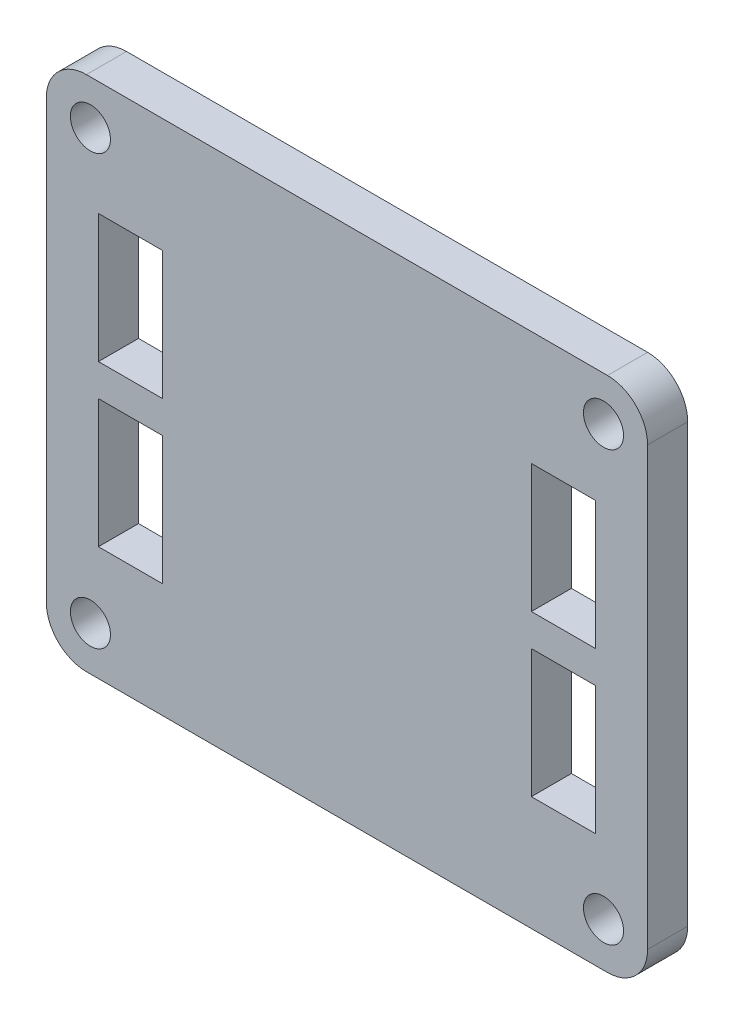
from build123d import *

# Parameters (mm, degrees)
SKETCH_1_W           = 75
SKETCH_1_H           = 64.5
EXTRUDE_1_DEPTH      = 5
EXTRUDE_2_DEPTH      = 2
EXTRUDE_2_DEPTH_BACK = 2
SKETCH_4_R           = 2.5
CUT_EXTRUDE_2_DEPTH  = 60.516345229
SKETCH_5_W           = 8
SKETCH_5_H           = 16
CUT_EXTRUDE_3_DEPTH  = 60.516345229
FILLET_1_R           = 5
SKETCH_6_W           = 33.787770844
SKETCH_6_H           = 60.601542709
CUT_EXTRUDE_4_DEPTH  = 10


with BuildPart() as part:
    # 草圖1 → 填料-伸長1 (new body)
    with BuildSketch(Plane.XY):
        Rectangle(SKETCH_1_W, SKETCH_1_H)
    extrude(amount=EXTRUDE_1_DEPTH)

    # 草圖2 → 填料-伸長2 (add, two sides: drawn at the far end of the back side and taken through both)
    with BuildSketch(Plane(origin=(0, 0, 0), x_dir=(0, 0, -1), z_dir=(1, 0, 0)).offset(-EXTRUDE_2_DEPTH_BACK)):
        Polygon((0, 29.870222578), (0, 0), (0, -29.870222578), (33.104121336, -21), (33.104121336, 21), align=None)
    extrude(amount=EXTRUDE_2_DEPTH + EXTRUDE_2_DEPTH_BACK)

    # 草圖4 → 除料-伸長2 (cut, through all)
    with BuildSketch(Plane(origin=(0, 0, 0), x_dir=(-1, 0, 0), z_dir=(0, 0, -1))):
        with Locations((32, 26.75)):
            Circle(SKETCH_4_R)
        with Locations(Location((32, -26.75, 0), (0, 0, 180))):
            Circle(SKETCH_4_R)
        with Locations((-32, -26.75)):
            Circle(SKETCH_4_R)
        with Locations(Location((-32, 26.75, 0), (0, 0, 180))):
            Circle(SKETCH_4_R)
    extrude(amount=-CUT_EXTRUDE_2_DEPTH, mode=Mode.SUBTRACT)

    # 草圖5 → 除料-伸長3 (cut, through all)
    with BuildSketch(Plane(origin=(0, 0, 0), x_dir=(-1, 0, 0), z_dir=(0, 0, -1))):
        with Locations((-27, 10)):
            Rectangle(SKETCH_5_W, SKETCH_5_H)
        with Locations((27, 10)):
            Rectangle(SKETCH_5_W, SKETCH_5_H)
        with Locations((27, -10)):
            Rectangle(SKETCH_5_W, SKETCH_5_H)
        with Locations((-27, -10)):
            Rectangle(SKETCH_5_W, SKETCH_5_H)
    extrude(amount=-CUT_EXTRUDE_3_DEPTH, mode=Mode.SUBTRACT)

    # 圓角1
    fillet_1_edges = [part.edges().sort_by_distance(p)[0] for p in [
        (0, -21, -33.104121336),
        (0, 21, -33.104121336),
        (-37.5, 32.25, 2.5),
        (37.5, 32.25, 2.5),
        (37.5, -32.25, 2.5),
        (-37.5, -32.25, 2.5),
    ]]
    fillet(fillet_1_edges, radius=FILLET_1_R)

    # 草圖6 → 除料-伸長4 (cut)
    with BuildSketch(Plane(origin=(2, 0, 0), x_dir=(0, 0, -1), z_dir=(1, 0, 0))):
        with Locations((16.893885422, -0.430548776)):
            Rectangle(SKETCH_6_W, SKETCH_6_H)
    extrude(amount=-CUT_EXTRUDE_4_DEPTH, mode=Mode.SUBTRACT)


solid = part.part
